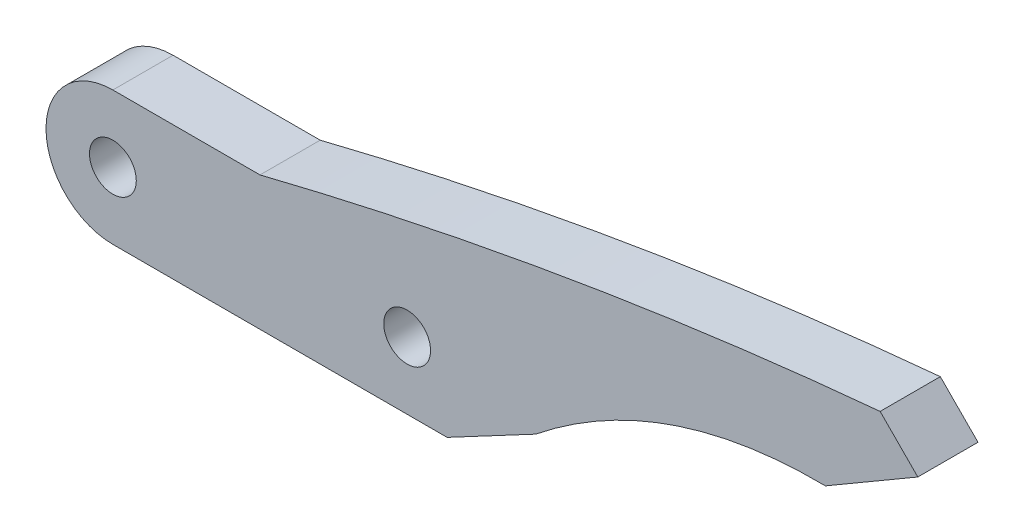
from build123d import *

# Parameters (mm, degrees)
SKETCH1_R           = 5
SKETCH1_R_2         = 1.75
BOSS_EXTRUDE1_DEPTH = 4.5
BOSS_EXTRUDE2_START = -4.5
BOSS_EXTRUDE2_DEPTH = 4.5


with BuildPart() as part:
    # Sketch1 → Boss-Extrude1 (new body)
    # profile 1 of 3: a face of its own
    with BuildSketch(Plane.XY):
        with Locations((-11, 0)):
            Circle(SKETCH1_R)
        with Locations((-11, 0)):
            Circle(SKETCH1_R_2, mode=Mode.SUBTRACT)
    # profile 2 of 3: a face of its own
    with BuildSketch(Plane.XY):
        with Locations((11, 0)):
            Circle(SKETCH1_R)
        with Locations((11, 0)):
            Circle(SKETCH1_R_2, mode=Mode.SUBTRACT)
    # profile 3 of 3: a face of its own
    with BuildSketch(Plane.XY):
        with BuildLine():
            Line((11, 5), (-11, 5))
            ThreePointArc((-11, 5), (-7.464466094, 3.535533906), (-6, 0))
            ThreePointArc((-6, 0), (-7.464466094, -3.535533906), (-11, -5))
            Line((-11, -5), (11.000000019, -5))
            ThreePointArc((11.000000019, -5), (6, -9e-09), (11, 5))
        make_face()
    extrude(amount=BOSS_EXTRUDE1_DEPTH)

    # Sketch2 → Boss-Extrude2 (add)
    with BuildSketch(Plane.XY.offset(4.5).offset(BOSS_EXTRUDE2_START)):
        with BuildLine():
            Line((46.363989199, 12.87), (49.180795902, 10.03))
            Line((49.180795902, 10.03), (42.27, 6))
            add(Edge.make_bspline(
                [(42.27, 6), (30.146150748, 6.157348305), (20.61, -1.48)],
                knots=[0, 0, 0, 1, 1, 1], degree=2))
            Line((20.61, -1.48), (13.99, -5))
            Line((13.99, -5), (11, -5))
            ThreePointArc((11, -5), (16, 0), (11, 5))
            Line((11, 5), (0, 5))
            add(Edge.make_bspline(
                [(0, 5), (22.885517501, 10.707926651), (46.363989199, 12.87)],
                knots=[0, 0, 0, 1, 1, 1], degree=2))
        make_face()
    extrude(amount=BOSS_EXTRUDE2_DEPTH)


solid = part.part
